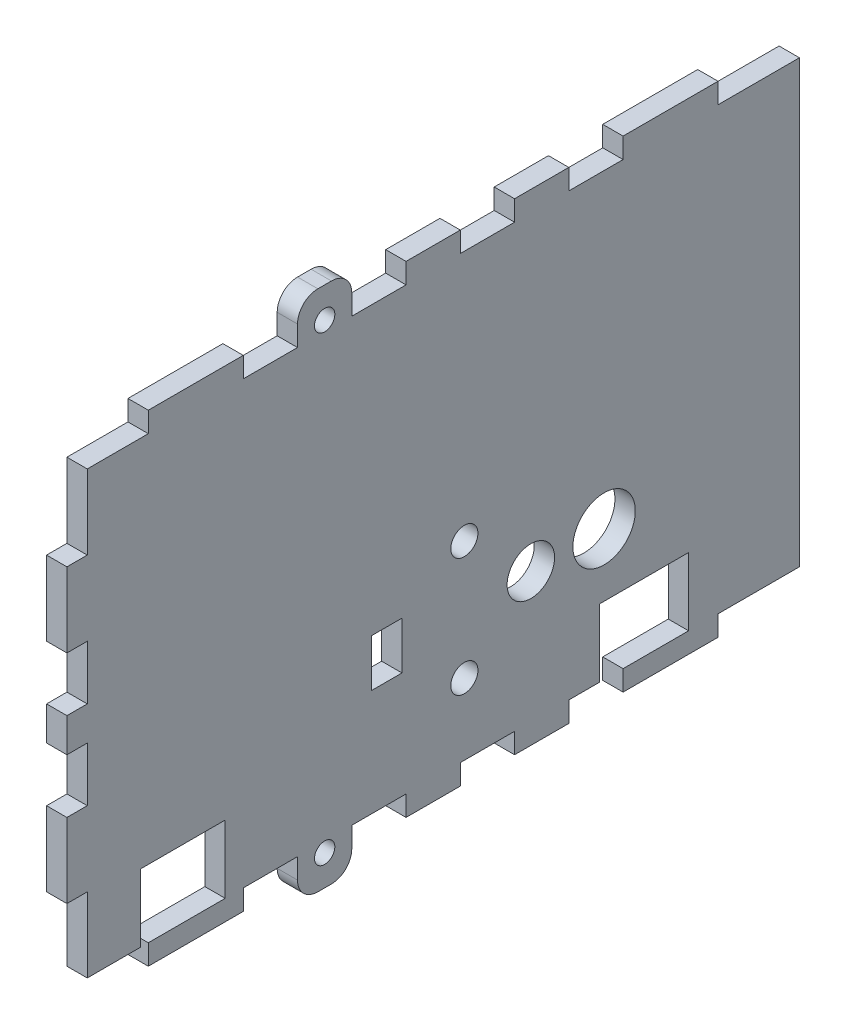
from build123d import *

# Parameters (mm, degrees)
CROQUIS1_W               = 108
CROQUIS1_H               = 71
SALIENTE_EXTRUIR1_DEPTH  = 1.5
CROQUIS2_W               = 12
CROQUIS2_H               = 3
CROQUIS2_W_2             = 8
CORTAR_EXTRUIR1_DEPTH    = 3
CROQUIS6_W               = 3
CROQUIS6_H               = 14
CROQUIS6_H_2             = 8
CORTAR_EXTRUIR3_DEPTH    = 3
CROQUIS8_W               = 8
CROQUIS8_H               = 3
SALIENTE_EXTRUIR2_DEPTH  = 3
REDONDEO2_R              = 3
CROQUIS9_R               = 1.5
CORTAR_EXTRUIR5_DEPTH    = 3
REDONDEO2_OF_SIMETR_A1_R = 3
CROQUIS10_R              = 4.6
CROQUIS10_R_2            = 3.5
CROQUIS10_R_3            = 2
CROQUIS10_W              = 4.5
CROQUIS10_H              = 7
CORTAR_EXTRUIR6_DEPTH    = 10
CROQUIS12_W              = 13.122983438
CROQUIS12_H              = 10
CROQUIS12_W_2            = 12.481361742
CORTAR_EXTRUIR7_DEPTH    = 10


with BuildPart() as part:
    # Croquis1 → Saliente-Extruir1 (new, symmetric)
    with BuildSketch(Plane(origin=(0, 0, 0), x_dir=(0, 0, -1), z_dir=(1, 0, 0))):
        Rectangle(CROQUIS1_W, CROQUIS1_H)
    extrude(amount=SALIENTE_EXTRUIR1_DEPTH, both=True)

    # Croquis2 → Cortar-Extruir1 (cut)
    with BuildSketch(Plane.ZY.offset(1.5)):
        with Locations((-48, -34)):
            Rectangle(CROQUIS2_W, CROQUIS2_H)
        with Locations((-24, -34)):
            Rectangle(CROQUIS2_W_2, CROQUIS2_H)
        with Locations((-8, -34)):
            Rectangle(CROQUIS2_W_2, CROQUIS2_H)
        with Locations((8, -34)):
            Rectangle(CROQUIS2_W_2, CROQUIS2_H)
        with Locations((24, -34)):
            Rectangle(CROQUIS2_W_2, CROQUIS2_H)
        with Locations((48, -34)):
            Rectangle(CROQUIS2_W, CROQUIS2_H)
        with Locations((48, 34)):
            Rectangle(CROQUIS2_W, CROQUIS2_H)
        with Locations((24, 34)):
            Rectangle(CROQUIS2_W_2, CROQUIS2_H)
        with Locations((8, 34)):
            Rectangle(CROQUIS2_W_2, CROQUIS2_H)
        with Locations((-8, 34)):
            Rectangle(CROQUIS2_W_2, CROQUIS2_H)
        with Locations((-24, 34)):
            Rectangle(CROQUIS2_W_2, CROQUIS2_H)
        with Locations((-48, 34)):
            Rectangle(CROQUIS2_W, CROQUIS2_H)
    extrude(amount=-CORTAR_EXTRUIR1_DEPTH, mode=Mode.SUBTRACT)

    # Croquis6 → Cortar-Extruir3 (cut)
    with BuildSketch(Plane.ZY.offset(1.5)):
        with Locations((52.5, -28.5)):
            Rectangle(CROQUIS6_W, CROQUIS6_H)
        with Locations((52.5, -6.5)):
            Rectangle(CROQUIS6_W, CROQUIS6_H_2)
        with Locations((52.5, 6.5)):
            Rectangle(CROQUIS6_W, CROQUIS6_H_2)
        with Locations((52.5, 28.5)):
            Rectangle(CROQUIS6_W, CROQUIS6_H)
    extrude(amount=-CORTAR_EXTRUIR3_DEPTH, mode=Mode.SUBTRACT)

    # Croquis8 → Saliente-Extruir2 (add)
    with BuildSketch(Plane.ZY.offset(1.5)):
        with Locations((16, 37)):
            Rectangle(CROQUIS8_W, CROQUIS8_H)
    saliente_extruir2 = extrude(amount=-SALIENTE_EXTRUIR2_DEPTH)

    # Redondeo2
    redondeo2_edges = [part.edges().sort_by_distance(p)[0] for p in [
        (0, 38.5, 12),
        (0, 38.5, 20),
    ]]
    fillet(redondeo2_edges, radius=REDONDEO2_R)

    # Croquis9 → Cortar-Extruir5 (cut)
    with BuildSketch(Plane.ZY.offset(1.5)):
        with Locations((16, 34)):
            Circle(CROQUIS9_R)
    cortar_extruir5 = extrude(amount=-CORTAR_EXTRUIR5_DEPTH, mode=Mode.SUBTRACT)

    # Simetría1: Saliente-Extruir2, Cortar-Extruir5 across plane
    add(saliente_extruir2.mirror(Plane.ZX))
    add(cortar_extruir5.mirror(Plane.ZX), mode=Mode.SUBTRACT)

    # Redondeo2 of Simetría1
    redondeo2_of_simetr_a1_edges = [part.edges().sort_by_distance(p)[0] for p in [
        (0, -38.5, 12),
        (0, -38.5, 20),
    ]]
    fillet(redondeo2_of_simetr_a1_edges, radius=REDONDEO2_OF_SIMETR_A1_R)

    # Croquis10 → Cortar-Extruir6 (cut)
    with BuildSketch(Plane.ZY.offset(1.5)):
        with Locations((-25.2, -13.25)):
            Circle(CROQUIS10_R)
        with Locations((-14.4, -13.25)):
            Circle(CROQUIS10_R_2)
        with Locations((-4.6, -22)):
            Circle(CROQUIS10_R_3)
        with Locations((-4.6, -4.5)):
            Circle(CROQUIS10_R_3)
        with Locations((6.85, -13.25)):
            Rectangle(CROQUIS10_W, CROQUIS10_H)
    extrude(amount=-CORTAR_EXTRUIR6_DEPTH, mode=Mode.SUBTRACT)

    # Croquis12 → Cortar-Extruir7 (cut)
    with BuildSketch(Plane.ZY.offset(1.5)):
        with Locations((-31.1, -27.5)):
            Rectangle(CROQUIS12_W, CROQUIS12_H)
        with Locations((36.9, -27.5)):
            Rectangle(CROQUIS12_W_2, CROQUIS12_H)
    extrude(amount=-CORTAR_EXTRUIR7_DEPTH, mode=Mode.SUBTRACT)


solid = part.part
